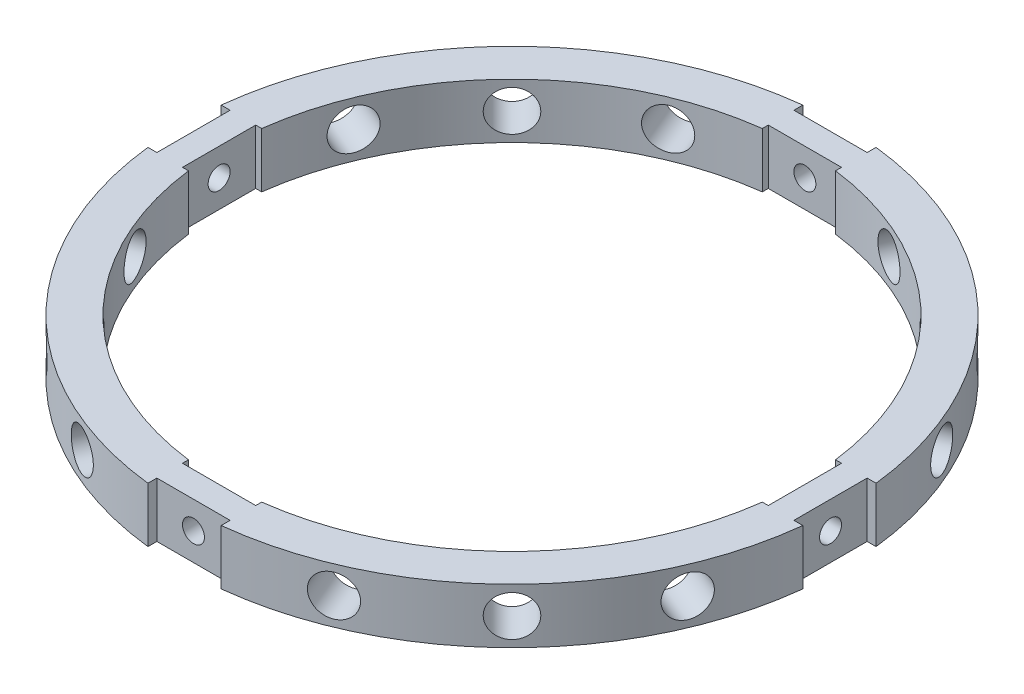
from build123d import *

# Parameters (mm, degrees)
BOSS_EXTRUDE1_DEPTH      = 7.5
BOSS_EXTRUDE1_DEPTH_BACK = 7.5
SKETCH1_R                = 90
SKETCH1_R_2              = 79
SKETCH6_W                = 20
SKETCH6_H                = 3
SKETCH6_W_2              = 3
SKETCH6_H_2              = 20
CUT_EXTRUDE4_DEPTH       = 129.16005618
SKETCH7_R                = 3
CUT_EXTRUDE5_DEPTH       = 198.960306939
SKETCH12_R               = 3
CUT_EXTRUDE8_DEPTH       = 198.960306943
SKETCH13_W               = 20
SKETCH13_H               = 3
SKETCH13_W_2             = 3
SKETCH13_H_2             = 20
CUT_EXTRUDE9_DEPTH       = 128.37739204
CUT_EXTRUDE10_DEPTH      = 127.7172488
CUT_EXTRUDE10_DEPTH_BACK = 127.7172488
SKETCH15_R               = 5.565
CUT_EXTRUDE11_DEPTH      = 127.714911759
CUT_EXTRUDE11_DEPTH_BACK = 127.714911759
SKETCH16_R               = 5.565
CUT_EXTRUDE12_DEPTH      = 127.717248947
CUT_EXTRUDE12_DEPTH_BACK = 127.717248947
SKETCH17_R               = 5.565
CUT_EXTRUDE13_DEPTH      = 127.714911759
CUT_EXTRUDE13_DEPTH_BACK = 127.714911759
SKETCH18_R               = 5.565
CUT_EXTRUDE14_DEPTH      = 127.713259122
CUT_EXTRUDE14_DEPTH_BACK = 127.713259122
SKETCH20_R               = 5.565
CUT_EXTRUDE15_DEPTH      = 127.713259122
CUT_EXTRUDE15_DEPTH_BACK = 127.713259122
SKETCH21_R               = 5.565


with BuildPart() as part:
    # Sketch1 → Boss-Extrude1 (new, two sides: drawn at the far end of the back side and taken through both)
    with BuildSketch(Plane(origin=(0, 0, 0), x_dir=(1, 0, 0), z_dir=(0, 1, 0)).offset(-BOSS_EXTRUDE1_DEPTH_BACK)):
        Circle(SKETCH1_R)
        Circle(SKETCH1_R_2, mode=Mode.SUBTRACT)
    extrude(amount=BOSS_EXTRUDE1_DEPTH + BOSS_EXTRUDE1_DEPTH_BACK)

    # Sketch6 → Cut-Extrude4 (cut, through all)
    with BuildSketch(Plane(origin=(0, 7.5, 0), x_dir=(1, 0, 0), z_dir=(0, 1, 0))):
        with Locations((0, -88.5)):
            Rectangle(SKETCH6_W, SKETCH6_H)
        with Locations((0, 88.5)):
            Rectangle(SKETCH6_W, SKETCH6_H)
        with Locations((88.5, 0)):
            Rectangle(SKETCH6_W_2, SKETCH6_H_2)
        with Locations((-88.5, 0)):
            Rectangle(SKETCH6_W_2, SKETCH6_H_2)
    extrude(amount=-CUT_EXTRUDE4_DEPTH, mode=Mode.SUBTRACT)

    # Sketch7 → Cut-Extrude5 (cut, through all)
    with BuildSketch(Plane.ZY.offset(87)):
        Circle(SKETCH7_R)
    extrude(amount=-CUT_EXTRUDE5_DEPTH, mode=Mode.SUBTRACT)

    # Sketch12 → Cut-Extrude8 (cut, through all)
    with BuildSketch(Plane.XY.offset(87)):
        Circle(SKETCH12_R)
    extrude(amount=-CUT_EXTRUDE8_DEPTH, mode=Mode.SUBTRACT)

    # Sketch13 → Cut-Extrude9 (cut, through all)
    with BuildSketch(Plane(origin=(0, 7.5, 0), x_dir=(1, 0, 0), z_dir=(0, 1, 0))):
        with Locations((0, -78.5)):
            Rectangle(SKETCH13_W, SKETCH13_H)
        with Locations((0, 78.5)):
            Rectangle(SKETCH13_W, SKETCH13_H)
        with Locations((-78.5, 0)):
            Rectangle(SKETCH13_W_2, SKETCH13_H_2)
        with Locations((78.5, 0)):
            Rectangle(SKETCH13_W_2, SKETCH13_H_2)
    extrude(amount=-CUT_EXTRUDE9_DEPTH, mode=Mode.SUBTRACT)

    # Sketch15 → Cut-Extrude10 (cut, two sides: drawn at the far end of the back side and taken through both)
    with BuildSketch(Plane(origin=(0.003996822, 0, -0.001655538), x_dir=(-0.38268343236509045, 0, -0.9238795325112865), z_dir=(0.9238795325112865, 0, -0.38268343236509045)).offset(-CUT_EXTRUDE10_DEPTH_BACK)):
        Circle(SKETCH15_R)
    extrude(amount=CUT_EXTRUDE10_DEPTH + CUT_EXTRUDE10_DEPTH_BACK, mode=Mode.SUBTRACT)

    # Sketch16 → Cut-Extrude11 (cut, two sides: drawn at the far end of the back side and taken through both)
    with BuildSketch(Plane(origin=(0.000685746, 0, -0.001655538), x_dir=(-0.9238795325112892, 0, -0.3826834323650838), z_dir=(0.3826834323650838, 0, -0.9238795325112892)).offset(-CUT_EXTRUDE11_DEPTH_BACK)):
        Circle(SKETCH16_R)
    extrude(amount=CUT_EXTRUDE11_DEPTH + CUT_EXTRUDE11_DEPTH_BACK, mode=Mode.SUBTRACT)

    # Sketch17 → Cut-Extrude12 (cut, two sides: drawn at the far end of the back side and taken through both)
    with BuildSketch(Plane(origin=(-0.001655538, 0, -0.003996822), x_dir=(-0.9238795325112865, 0, 0.38268343236509045), z_dir=(-0.38268343236509045, 0, -0.9238795325112865)).offset(-CUT_EXTRUDE12_DEPTH_BACK)):
        Circle(SKETCH17_R)
    extrude(amount=CUT_EXTRUDE12_DEPTH + CUT_EXTRUDE12_DEPTH_BACK, mode=Mode.SUBTRACT)

    # Sketch18 → Cut-Extrude13 (cut, two sides: drawn at the far end of the back side and taken through both)
    with BuildSketch(Plane(origin=(-0.001655538, 0, -0.000685746), x_dir=(-0.3826834323650839, 0, 0.9238795325112892), z_dir=(-0.9238795325112892, 0, -0.3826834323650839)).offset(-CUT_EXTRUDE13_DEPTH_BACK)):
        with Locations((0.475660887, 0)):
            Circle(SKETCH18_R)
    extrude(amount=CUT_EXTRUDE13_DEPTH + CUT_EXTRUDE13_DEPTH_BACK, mode=Mode.SUBTRACT)

    # Sketch20 → Cut-Extrude14 (cut, two sides: drawn at the far end of the back side and taken through both)
    with BuildSketch(Plane(origin=(0, 0, 0), x_dir=(-0.7071067811865474, 0, -0.7071067811865477), z_dir=(0.7071067811865477, 0, -0.7071067811865474)).offset(-CUT_EXTRUDE14_DEPTH_BACK)):
        Circle(SKETCH20_R)
    extrude(amount=CUT_EXTRUDE14_DEPTH + CUT_EXTRUDE14_DEPTH_BACK, mode=Mode.SUBTRACT)

    # Sketch21 → Cut-Extrude15 (cut, two sides: drawn at the far end of the back side and taken through both)
    with BuildSketch(Plane(origin=(0, 0, 0), x_dir=(-0.7071067811865476, 0, 0.7071067811865476), z_dir=(-0.7071067811865476, 0, -0.7071067811865476)).offset(-CUT_EXTRUDE15_DEPTH_BACK)):
        Circle(SKETCH21_R)
    extrude(amount=CUT_EXTRUDE15_DEPTH + CUT_EXTRUDE15_DEPTH_BACK, mode=Mode.SUBTRACT)


solid = part.part
